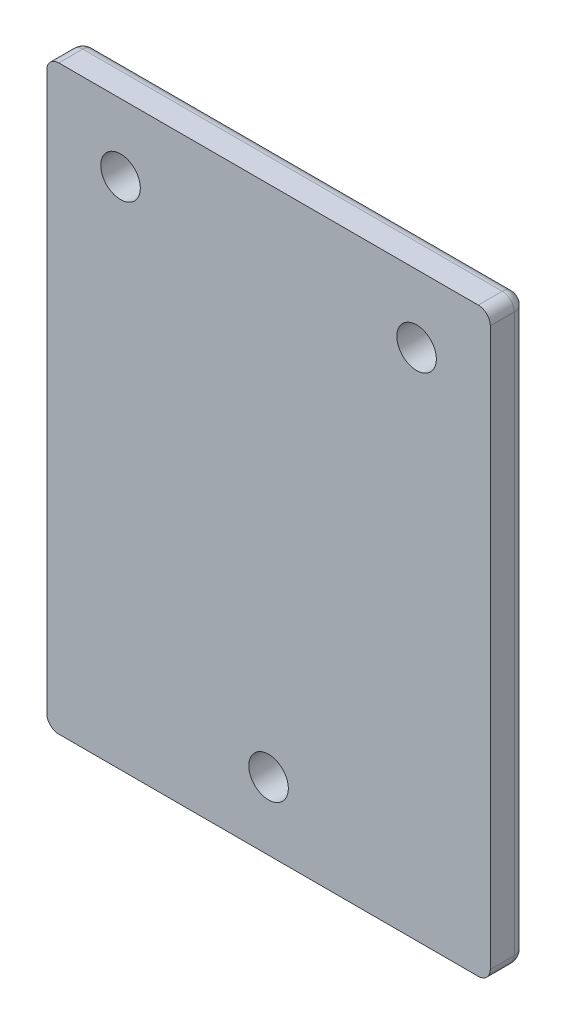
from build123d import *

# Parameters (mm, degrees)
SKETCH1_W           = 31
SKETCH1_H           = 42.5
BOSS_EXTRUDE1_DEPTH = 3
SKETCH2_W           = 37
SKETCH2_H           = 48.5
SKETCH2_W_2         = 31
SKETCH2_H_2         = 42.5
BOSS_EXTRUDE2_DEPTH = 3
CUT_EXTRUDE1_REACH  = 32.648
SKETCH3_R           = 1.65
FILLET4_R           = 1


with BuildPart() as part:
    # Sketch1 → Boss-Extrude1 (new body)
    with BuildSketch(Plane.XY):
        Rectangle(SKETCH1_W, SKETCH1_H)
    extrude(amount=BOSS_EXTRUDE1_DEPTH)

    # Sketch2 → Boss-Extrude2 (add)
    with BuildSketch(Plane.XY):
        Rectangle(SKETCH2_W, SKETCH2_H)
        Rectangle(SKETCH2_W_2, SKETCH2_H_2, mode=Mode.SUBTRACT)
    extrude(amount=BOSS_EXTRUDE2_DEPTH)

    # Sketch3 → Cut-Extrude1 (cut, up to next)
    with BuildSketch(Plane(origin=(0, 0, 0), x_dir=(-1, 0, 0), z_dir=(0, 0, -1)), mode=Mode.PRIVATE) as cut_extrude1_sk1:
        with Locations((12.35, 18.6)):
            Circle(SKETCH3_R)
    cut_extrude1_tool1 = extrude(cut_extrude1_sk1.sketch, amount=-CUT_EXTRUDE1_REACH, mode=Mode.PRIVATE) & part.part
    # Sketch3 → Cut-Extrude1 (cut, up to next)
    with BuildSketch(Plane(origin=(0, 0, 0), x_dir=(-1, 0, 0), z_dir=(0, 0, -1)), mode=Mode.PRIVATE) as cut_extrude1_sk2:
        with Locations((0, -18.6)):
            Circle(SKETCH3_R)
    cut_extrude1_tool2 = extrude(cut_extrude1_sk2.sketch, amount=-CUT_EXTRUDE1_REACH, mode=Mode.PRIVATE) & part.part
    cut_extrude1_1 = cut_extrude1_tool1.solids().sort_by_distance((-12.35, 18.6, 0))[0]
    add(cut_extrude1_1, mode=Mode.SUBTRACT)
    cut_extrude1_2 = cut_extrude1_tool2.solids().sort_by_distance((0, -18.6, 0))[0]
    add(cut_extrude1_2, mode=Mode.SUBTRACT)
    cut_extrude1 = cut_extrude1_1 + cut_extrude1_2  # Cut-Extrude1 as one shape, for the pattern or mirror that repeats it

    # Mirror1: Cut-Extrude1 across plane
    add(cut_extrude1.mirror(Plane(origin=(0, 0, 0), x_dir=(0, 0, 1), z_dir=(1, 0, 0))), mode=Mode.SUBTRACT)

    # Fillet4
    fillet4_edges = [part.edges().sort_by_distance(p)[0] for p in [
        (0, -24.25, 0),
        (-18.5, -24.25, 1.5),
        (18.5, 0, 0),
        (18.5, -24.25, 1.5),
        (0, 24.25, 0),
        (18.5, 24.25, 1.5),
        (-18.5, 0, 0),
        (-18.5, 24.25, 1.5),
    ]]
    fillet(fillet4_edges, radius=FILLET4_R)


solid = part.part
